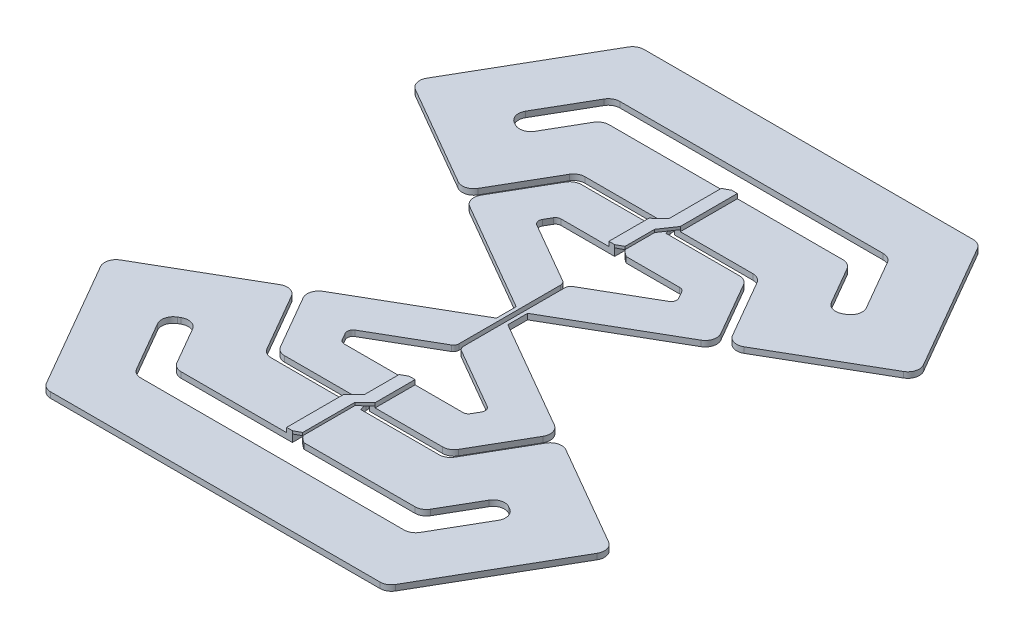
from build123d import *

# Parameters (mm, degrees)
EXTRUDE_6_DEPTH          = 1
EXTRUDE_6_2_DEPTH        = 1
EXTRUDE_6_3_DEPTH        = 1
EXTRUDE_6_4_DEPTH        = 1
CUT_EXTRUDE_1_DEPTH      = 2
CUT_EXTRUDE_1_DEPTH_BACK = 2
SKETCH_2_W               = 2
SKETCH_2_H               = 80
EXTRUDE_7_DEPTH          = 1
SKETCH_5_W               = 1
SKETCH_5_H               = 10
SKETCH_5_H_2             = 7
EXTRUDE_8_DEPTH          = 0.8
EXTRUDE_9_DEPTH          = 0.5


with BuildPart() as part:
    # 草图3 → 凸台-拉伸6 (new body)
    with BuildSketch(Plane(origin=(0, 0, 0), x_dir=(1, 0, 0), z_dir=(0, 1, 0))):
        with BuildLine():
            Line((43.5, 28.578838325), (30.577350269, 50.961524227))
            ThreePointArc((30.577350269, 50.961524227), (29.845299462, 51.693575035), (28.845299462, 51.961524227))
            Line((28.845299462, 51.961524227), (-28.845299462, 51.961524227))
            ThreePointArc((-28.845299462, 51.961524227), (-29.845299462, 51.693575035), (-30.577350269, 50.961524227))
            Line((-30.577350269, 50.961524227), (-43.5, 28.578838325))
            ThreePointArc((-43.5, 28.578838325), (-43.699800845, 27.061200235), (-42.767949192, 25.846787517))
            Line((-42.767949192, 25.846787517), (-25.031088913, 15.606406461))
            ThreePointArc((-25.031088913, 15.606406461), (-23.513450823, 15.406605616), (-22.299038106, 16.338457268))
            Line((-22.299038106, 16.338457268), (-16.443375673, 26.480762114))
            ThreePointArc((-16.443375673, 26.480762114), (-15.711324865, 27.212812921), (-14.711324865, 27.480762114))
            Line((-14.711324865, 27.480762114), (14.711324865, 27.480762114))
            ThreePointArc((14.711324865, 27.480762114), (15.711324865, 27.212812921), (16.443375673, 26.480762114))
            Line((16.443375673, 26.480762114), (22.299038106, 16.338457268))
            ThreePointArc((22.299038106, 16.338457268), (23.513450823, 15.406605616), (25.031088913, 15.606406461))
            Line((25.031088913, 15.606406461), (42.767949192, 25.846787517))
            ThreePointArc((42.767949192, 25.846787517), (43.699800845, 27.061200235), (43.5, 28.578838325))
        make_face()
        with BuildLine():
            Line((29.839745962, 32.239092363), (24.803847577, 40.961524227))
            ThreePointArc((24.803847577, 40.961524227), (24.07179677, 41.693575035), (23.07179677, 41.961524227))
            Line((23.07179677, 41.961524227), (-23.07179677, 41.961524227))
            ThreePointArc((-23.07179677, 41.961524227), (-24.07179677, 41.693575035), (-24.803847577, 40.961524227))
            Line((-24.803847577, 40.961524227), (-29.839745962, 32.239092363))
            ThreePointArc((-29.839745962, 32.239092363), (-30.039546807, 30.721454273), (-29.107695155, 29.507041555))
            Line((-29.107695155, 29.507041555), (-28.691342951, 29.266660498))
            ThreePointArc((-28.691342951, 29.266660498), (-27.173704861, 29.066859653), (-25.959292144, 29.998711306))
            Line((-25.959292144, 29.998711306), (-22.216878365, 36.480762114))
            ThreePointArc((-22.216878365, 36.480762114), (-21.484827557, 37.212812921), (-20.484827557, 37.480762114))
            Line((-20.484827557, 37.480762114), (20.484827557, 37.480762114))
            ThreePointArc((20.484827557, 37.480762114), (21.484827557, 37.212812921), (22.216878365, 36.480762114))
            Line((22.216878365, 36.480762114), (25.959292144, 29.998711306))
            ThreePointArc((25.959292144, 29.998711306), (27.173704861, 29.066859653), (28.691342951, 29.266660498))
            Line((28.691342951, 29.266660498), (29.107695155, 29.507041555))
            ThreePointArc((29.107695155, 29.507041555), (30.039546807, 30.721454273), (29.839745962, 32.239092363))
        make_face(mode=Mode.SUBTRACT)
    extrude(amount=EXTRUDE_6_DEPTH)


with BuildPart() as body_2:
    # 草图3 → Extrude 6 2 (new body)
    with BuildSketch(Plane(origin=(0, 0, 0), x_dir=(1, 0, 0), z_dir=(0, 1, 0))):
        with BuildLine():
            Line((-43.5, -28.578838325), (-30.577350269, -50.961524227))
            ThreePointArc((-30.577350269, -50.961524227), (-29.845299462, -51.693575035), (-28.845299462, -51.961524227))
            Line((-28.845299462, -51.961524227), (28.845299462, -51.961524227))
            ThreePointArc((28.845299462, -51.961524227), (29.845299462, -51.693575035), (30.577350269, -50.961524227))
            Line((30.577350269, -50.961524227), (43.5, -28.578838325))
            ThreePointArc((43.5, -28.578838325), (43.699800845, -27.061200235), (42.767949192, -25.846787517))
            Line((42.767949192, -25.846787517), (25.031088913, -15.606406461))
            ThreePointArc((25.031088913, -15.606406461), (23.513450823, -15.406605616), (22.299038106, -16.338457268))
            Line((22.299038106, -16.338457268), (16.443375673, -26.480762114))
            ThreePointArc((16.443375673, -26.480762114), (15.711324865, -27.212812921), (14.711324865, -27.480762114))
            Line((14.711324865, -27.480762114), (-14.711324865, -27.480762114))
            ThreePointArc((-14.711324865, -27.480762114), (-15.711324865, -27.212812921), (-16.443375673, -26.480762114))
            Line((-16.443375673, -26.480762114), (-22.299038106, -16.338457268))
            ThreePointArc((-22.299038106, -16.338457268), (-23.513450823, -15.406605616), (-25.031088913, -15.606406461))
            Line((-25.031088913, -15.606406461), (-42.767949192, -25.846787517))
            ThreePointArc((-42.767949192, -25.846787517), (-43.699800845, -27.061200235), (-43.5, -28.578838325))
        make_face()
        with BuildLine():
            Line((29.107695155, -29.507041555), (28.691342951, -29.266660498))
            ThreePointArc((28.691342951, -29.266660498), (27.173704861, -29.066859653), (25.959292144, -29.998711306))
            Line((25.959292144, -29.998711306), (22.216878365, -36.480762114))
            ThreePointArc((22.216878365, -36.480762114), (21.484827557, -37.212812921), (20.484827557, -37.480762114))
            Line((20.484827557, -37.480762114), (-20.484827557, -37.480762114))
            ThreePointArc((-20.484827557, -37.480762114), (-21.484827557, -37.212812921), (-22.216878365, -36.480762114))
            Line((-22.216878365, -36.480762114), (-25.959292144, -29.998711306))
            ThreePointArc((-25.959292144, -29.998711306), (-27.173704861, -29.066859653), (-28.691342951, -29.266660498))
            Line((-28.691342951, -29.266660498), (-29.107695155, -29.507041555))
            ThreePointArc((-29.107695155, -29.507041555), (-30.039546807, -30.721454273), (-29.839745962, -32.239092363))
            Line((-29.839745962, -32.239092363), (-24.803847577, -40.961524227))
            ThreePointArc((-24.803847577, -40.961524227), (-24.07179677, -41.693575035), (-23.07179677, -41.961524227))
            Line((-23.07179677, -41.961524227), (23.07179677, -41.961524227))
            ThreePointArc((23.07179677, -41.961524227), (24.07179677, -41.693575035), (24.803847577, -40.961524227))
            Line((24.803847577, -40.961524227), (29.839745962, -32.239092363))
            ThreePointArc((29.839745962, -32.239092363), (30.039546807, -30.721454273), (29.107695155, -29.507041555))
        make_face(mode=Mode.SUBTRACT)
    extrude(amount=EXTRUDE_6_2_DEPTH)


with BuildPart() as body_3:
    # 草图3 → Extrude 6 3 (new body)
    with BuildSketch(Plane(origin=(0, 0, 0), x_dir=(1, 0, 0), z_dir=(0, 1, 0))):
        with BuildLine():
            Line((13.845299462, 25.980762114), (-13.845299462, 25.980762114))
            ThreePointArc((-13.845299462, 25.980762114), (-14.845299462, 25.712812921), (-15.577350269, 24.980762114))
            Line((-15.577350269, 24.980762114), (-21, 15.588457268))
            ThreePointArc((-21, 15.588457268), (-21.199800845, 14.070819178), (-20.267949192, 12.856406461))
            Line((-20.267949192, 12.856406461), (0, 1.154700538))
            Line((0, 1.154700538), (20.267949192, 12.856406461))
            ThreePointArc((20.267949192, 12.856406461), (21.199800845, 14.070819178), (21, 15.588457268))
            Line((21, 15.588457268), (15.577350269, 24.980762114))
            ThreePointArc((15.577350269, 24.980762114), (14.845299462, 25.712812921), (13.845299462, 25.980762114))
        make_face()
        with BuildLine():
            Line((10.381197846, 18.980762114), (-10.381197846, 18.980762114))
            ThreePointArc((-10.381197846, 18.980762114), (-10.881197846, 18.846787517), (-11.24722325, 18.480762114))
            Line((-11.24722325, 18.480762114), (-11.937822174, 17.284609691))
            ThreePointArc((-11.937822174, 17.284609691), (-12.037722596, 16.525790646), (-11.57179677, 15.918584287))
            Line((-11.57179677, 15.918584287), (0, 9.237604307))
            Line((0, 9.237604307), (11.57179677, 15.918584287))
            ThreePointArc((11.57179677, 15.918584287), (12.037722596, 16.525790646), (11.937822174, 17.284609691))
            Line((11.937822174, 17.284609691), (11.24722325, 18.480762114))
            ThreePointArc((11.24722325, 18.480762114), (10.881197846, 18.846787517), (10.381197846, 18.980762114))
        make_face(mode=Mode.SUBTRACT)
    extrude(amount=EXTRUDE_6_3_DEPTH)


with BuildPart() as body_4:
    # 草图3 → Extrude 6 4 (new body)
    with BuildSketch(Plane(origin=(0, 0, 0), x_dir=(1, 0, 0), z_dir=(0, 1, 0))):
        with BuildLine():
            Line((-21, -15.588457268), (-15.577350269, -24.980762114))
            ThreePointArc((-15.577350269, -24.980762114), (-14.845299462, -25.712812921), (-13.845299462, -25.980762114))
            Line((-13.845299462, -25.980762114), (13.845299462, -25.980762114))
            ThreePointArc((13.845299462, -25.980762114), (14.845299462, -25.712812921), (15.577350269, -24.980762114))
            Line((15.577350269, -24.980762114), (21, -15.588457268))
            ThreePointArc((21, -15.588457268), (21.199800845, -14.070819178), (20.267949192, -12.856406461))
            Line((20.267949192, -12.856406461), (0, -1.154700538))
            Line((0, -1.154700538), (-20.267949192, -12.856406461))
            ThreePointArc((-20.267949192, -12.856406461), (-21.199800845, -14.070819178), (-21, -15.588457268))
        make_face()
        with BuildLine():
            Line((-11.57179677, -15.918584287), (0, -9.237604307))
            Line((0, -9.237604307), (11.57179677, -15.918584287))
            ThreePointArc((11.57179677, -15.918584287), (12.037722596, -16.525790646), (11.937822174, -17.284609691))
            Line((11.937822174, -17.284609691), (11.24722325, -18.480762114))
            ThreePointArc((11.24722325, -18.480762114), (10.881197846, -18.846787517), (10.381197846, -18.980762114))
            Line((10.381197846, -18.980762114), (-10.381197846, -18.980762114))
            ThreePointArc((-10.381197846, -18.980762114), (-10.881197846, -18.846787517), (-11.24722325, -18.480762114))
            Line((-11.24722325, -18.480762114), (-11.937822174, -17.284609691))
            ThreePointArc((-11.937822174, -17.284609691), (-12.037722596, -16.525790646), (-11.57179677, -15.918584287))
        make_face(mode=Mode.SUBTRACT)
    extrude(amount=EXTRUDE_6_4_DEPTH)


with BuildPart() as cut_extrude_1_tool:
    # 草图2 → 切除-拉伸1 (new, two sides: drawn at the far end of the back side and taken through both)
    with BuildSketch(Plane(origin=(0, 0, 0), x_dir=(1, 0, 0), z_dir=(0, 1, 0)).offset(-CUT_EXTRUDE_1_DEPTH_BACK)):
        with Locations((0, 1.188054459)):
            Rectangle(SKETCH_2_W, SKETCH_2_H)
    extrude(amount=CUT_EXTRUDE_1_DEPTH + CUT_EXTRUDE_1_DEPTH_BACK)


with BuildPart() as part_1:
    add(part.part)

    # 切除-拉伸1: cut by cut_extrude_1_tool
    add(cut_extrude_1_tool.part, mode=Mode.SUBTRACT)



with BuildPart() as body_2_1:
    add(body_2.part)

    # 切除-拉伸1: cut by cut_extrude_1_tool
    add(cut_extrude_1_tool.part, mode=Mode.SUBTRACT)


with BuildPart() as body_3_1:
    add(body_3.part)

    # 切除-拉伸1: cut by cut_extrude_1_tool
    add(cut_extrude_1_tool.part, mode=Mode.SUBTRACT)



with BuildPart() as body_4_1:
    add(body_4.part)

    # 切除-拉伸1: cut by cut_extrude_1_tool
    add(cut_extrude_1_tool.part, mode=Mode.SUBTRACT)


with BuildPart() as body_3_2:
    add(body_3_1.part)

    add(body_4_1.part)  # 凸台-拉伸7 merges body 4
    # 草图4 → 凸台-拉伸7 (add)
    with BuildSketch(Plane(origin=(0, 0, 0), x_dir=(1, 0, 0), z_dir=(0, 1, 0))):
        with BuildLine():
            Line((-1, 9.814954576), (-0.888790853, 9.750747945))
            ThreePointArc((-0.888790853, 9.750747945), (-0.522765449, 9.384722541), (-0.388790853, 8.884722541))
            Line((-0.388790853, 8.884722541), (-0.388790853, -8.884722541))
            ThreePointArc((-0.388790853, -8.884722541), (-0.522765449, -9.384722541), (-0.888790853, -9.750747945))
            Line((-0.888790853, -9.750747945), (-1, -9.814954576))
            Line((-1, -9.814954576), (-1, -1.732050808))
            Line((-1, -1.732050808), (-1, 1.732050808))
            Line((-1, 1.732050808), (-1, 9.814954576))
        make_face()
        with BuildLine():
            Line((0.388790853, 8.884722541), (0.388790853, -8.884722541))
            ThreePointArc((0.388790853, -8.884722541), (0.522765449, -9.384722541), (0.888790853, -9.750747945))
            Line((0.888790853, -9.750747945), (1, -9.814954576))
            Line((1, -9.814954576), (1, -1.732050808))
            Line((1, -1.732050808), (1, 1.732050808))
            Line((1, 1.732050808), (1, 9.814954576))
            Line((1, 9.814954576), (0.888790853, 9.750747945))
            ThreePointArc((0.888790853, 9.750747945), (0.522765449, 9.384722541), (0.388790853, 8.884722541))
        make_face()
        with BuildLine():
            Line((-1, 37.480762114), (-0.415213565, 37.044452721))
            ThreePointArc((-0.415213565, 37.044452721), (0.176525615, 36.338120157), (0.388790853, 35.441457222))
            Line((0.388790853, 35.441457222), (0.388790853, 27.877831941))
            ThreePointArc((0.388790853, 27.877831941), (0.427078741, 27.488363596), (0.540476444, 27.113807172))
            Line((0.540476444, 27.113807172), (1, 26.002136394))
            Line((1, 26.002136394), (1, 18.980762114))
            Line((1, 18.980762114), (0.40304567, 19.426149978))
            ThreePointArc((0.40304567, 19.426149978), (-0.189789684, 20.134671397), (-0.400952755, 21.034041463))
            Line((-0.400952755, 21.034041463), (-0.389769107, 25.602522658))
            ThreePointArc((-0.389769107, 25.602522658), (-0.427575764, 25.994485567), (-0.541448706, 26.371443415))
            Line((-0.541448706, 26.371443415), (-1, 27.480762114))
            Line((-1, 27.480762114), (-1, 37.480762114))
        make_face()
        with BuildLine():
            Line((-1, -18.980762114), (-0.229825281, -19.555389779))
            ThreePointArc((-0.229825281, -19.555389779), (0.361913899, -20.261722343), (0.574179137, -21.158385277))
            Line((0.574179137, -21.158385277), (0.574179137, -25.702381427))
            ThreePointArc((0.574179137, -25.702381427), (0.593276045, -25.978104008), (0.650202079, -26.248561141))
            Line((0.650202079, -26.248561141), (1, -27.480762114))
            Line((1, -27.480762114), (1, -37.480762114))
            Line((1, -37.480762114), (0.407695692, -37.038843632))
            ThreePointArc((0.407695692, -37.038843632), (-0.184043489, -36.332511068), (-0.396308726, -35.435848134))
            Line((-0.396308726, -35.435848134), (-0.396308726, -27.868125603))
            ThreePointArc((-0.396308726, -27.868125603), (-0.432797892, -27.487829399), (-0.540933929, -27.121409886))
            Line((-0.540933929, -27.121409886), (-1, -25.980762114))
            Line((-1, -25.980762114), (-1, -18.980762114))
        make_face()
    extrude(amount=EXTRUDE_7_DEPTH)


with BuildPart() as part_2:
    add(part_1.part)

    add(body_2_1.part)  # 凸台-拉伸8 merges body 2

    add(body_3_2.part)  # 凸台-拉伸8 merges body 3
    # 草图5 → 凸台-拉伸8 (add)
    with BuildSketch(Plane(origin=(0, 1, 0), x_dir=(1, 0, 0), z_dir=(0, 1, 0))):
        with Locations((1.5, 32.480762114)):
            Rectangle(SKETCH_5_W, SKETCH_5_H)
        with Locations((-1.5, 22.480762114)):
            Rectangle(SKETCH_5_W, SKETCH_5_H_2)
        with Locations((1.5, -22.480762114)):
            Rectangle(SKETCH_5_W, SKETCH_5_H_2)
        with Locations((-1.5, -32.480762114)):
            Rectangle(SKETCH_5_W, SKETCH_5_H)
    extrude(amount=EXTRUDE_8_DEPTH)

    # 草图6 → 凸台-拉伸9 (add)
    with BuildSketch(Plane(origin=(0, 1.3, 0), x_dir=(1, 0, 0), z_dir=(0, 1, 0))):
        Polygon((1, 37.480762114), (-0.183368806, 36.84191142), (-0.183368806, 27.709818379), (-2, 25.980762114), (-1, 25.980762114), (-1, 18.980762114), (0.181282186, 19.618486329), (0.181282186, 24.807110832), (2, 27.480762114), (1, 27.480762114), align=None)
        Polygon((1, -18.980762114), (-0.162166586, -19.608166626), (-0.162166586, -25.73152573), (-2, -27.480762114), (-1, -27.480762114), (-1, -37.480762114), (0.18206846, -36.842613422), (0.18206846, -27.711056039), (2, -25.980762114), (1, -25.980762114), align=None)
    extrude(amount=EXTRUDE_9_DEPTH)


solid = part_2.part
